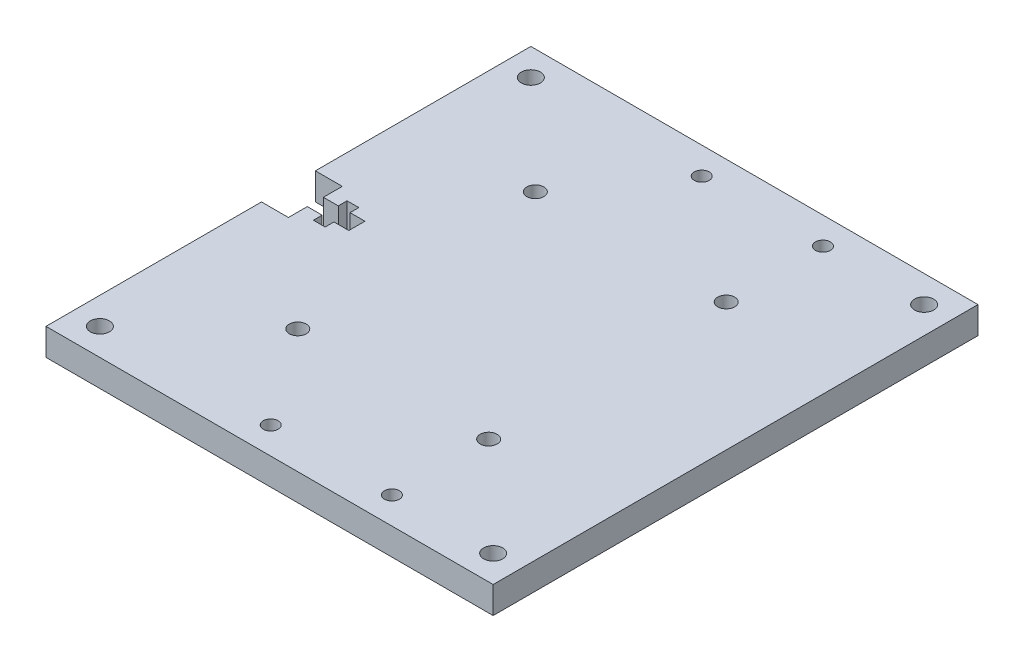
from build123d import *

# Parameters (mm, degrees)
SKETCH1_W                      = 105.41
SKETCH1_H                      = 114.3
BOSS_EXTRUDE1_DEPTH            = 3.175
F_4_0_4_DIAMETER_HOLE1_D       = 4
LPATTERN1_COUNT                = 2
LPATTERN1_PITCH                = 56
LPATTERN1_COUNT_DIR2           = 2
LPATTERN1_PITCH_DIR2           = 45
F_8_CLEARANCE_HOLE1_D          = 4.4958
MIRROR2_COPY_1_D               = 4.4958
F_6_CLEARANCE_HOLE1_AT_2_COUNT = 2
F_6_CLEARANCE_HOLE1_AT_2_PITCH = 28.575
CUT_EXTRUDE1_REACH             = 80.002


with BuildPart() as part:
    # Sketch1 → Boss-Extrude1 (new, symmetric)
    with BuildSketch(Plane(origin=(0, 0, 0), x_dir=(1, 0, 0), z_dir=(0, 1, 0))):
        Rectangle(SKETCH1_W, SKETCH1_H)
    extrude(amount=BOSS_EXTRUDE1_DEPTH, both=True)

    # Ø4.0 (4) Diameter Hole1 (through all)
    with Locations(Plane(origin=(0, 3.175, 0), x_dir=(1, 0, 0), z_dir=(0, 1, 0))):
        with Locations((22.5, 28)):
            f_4_0_4_diameter_hole1 = Hole(F_4_0_4_DIAMETER_HOLE1_D / 2)

    # LPattern1: 4.0 _4_ Diameter Hole1 2 × 2
    with Locations(*[(-j * LPATTERN1_PITCH_DIR2, 0, i * LPATTERN1_PITCH) for i in range(LPATTERN1_COUNT) for j in range(LPATTERN1_COUNT_DIR2) if (i, j) != (0, 0)]):
        add(f_4_0_4_diameter_hole1, mode=Mode.SUBTRACT)

    # #8 Clearance Hole1 (through all)
    with Locations(Plane(origin=(0, 3.175, 0), x_dir=(1, 0, 0), z_dir=(0, 1, 0))):
        with Locations((-46.355, 50.8)):
            f_8_clearance_hole1 = Hole(F_8_CLEARANCE_HOLE1_D / 2)

    # Mirror1: #8 Clearance Hole1 across plane
    add(f_8_clearance_hole1.mirror(Plane.XY), mode=Mode.SUBTRACT)

    # Mirror2: #8 Clearance Hole1 across plane
    add(f_8_clearance_hole1.mirror(Plane(origin=(0, 0, 0), x_dir=(0, 0, 1), z_dir=(1, 0, 0))), mode=Mode.SUBTRACT)

    # Mirror2 copy 1 (through all)
    with Locations(Plane(origin=(0, 3.175, 0), x_dir=(-1, 0, 0), z_dir=(0, 1, 0))):
        with Locations((-46.355, 50.8)):
            Hole(MIRROR2_COPY_1_D / 2)

    # Sketch6 → #6 Clearance Hole1 (revolve, cut)
    with BuildSketch(Plane(origin=(22.5, 3.175, -50.8), x_dir=(0, 0, 1), z_dir=(1, 0, 0))):
        Polygon((0, 0), (0, 7.403068321), (1.7526, 6.35), (1.7526, 0), align=None)
    f_6_clearance_hole1 = revolve(axis=Axis((22.5, 9.525, -50.8), (0, -1, 0)), mode=Mode.SUBTRACT)

    # #6 Clearance Hole1 at 2: #6 Clearance Hole1 ×2
    with Locations(*[(-i * F_6_CLEARANCE_HOLE1_AT_2_PITCH, 0, 0) for i in range(1, F_6_CLEARANCE_HOLE1_AT_2_COUNT)]):
        add(f_6_clearance_hole1, mode=Mode.SUBTRACT)

    # Sketch8 → Cut-Extrude1 (cut, up to next)
    with BuildSketch(Plane(origin=(0, 3.175, 0), x_dir=(1, 0, 0), z_dir=(0, 1, 0)), mode=Mode.PRIVATE) as cut_extrude1_sk1:
        Polygon((-52.705, -6.35), (-52.705, 6.35), (-46.355, 6.35), (-46.355, 1.89865), (-42.8545625, 1.89865), (-42.8545625, 3.96875), (-40.0764375, 3.96875), (-40.0764375, 1.89865), (-36.576, 1.89865), (-36.576, -1.89865), (-40.0764375, -1.89865), (-40.0764375, -3.96875), (-42.8545625, -3.96875), (-42.8545625, -1.89865), (-46.355, -1.89865), (-46.355, -6.35), align=None)
    cut_extrude1_tool1 = extrude(cut_extrude1_sk1.sketch, amount=-CUT_EXTRUDE1_REACH, mode=Mode.PRIVATE) & part.part
    add(cut_extrude1_tool1.solids().sort_by_distance((-46.496113, 3.175, 0))[0], mode=Mode.SUBTRACT)

    # Mirror3: #6 Clearance Hole1 across plane
    add(f_6_clearance_hole1.mirror(Plane.XY), mode=Mode.SUBTRACT)

    # Mirror3 copy 1 sketch → Mirror3 copy 1 (revolve, cut)
    with BuildSketch(Plane(origin=(-6.075, 3.175, 50.8), x_dir=(0, 0, -1), z_dir=(1, 0, 0))):
        Polygon((0, 0), (0, -7.403068321), (1.7526, -6.35), (1.7526, 0), align=None)
    revolve(axis=Axis((-6.075, 9.525, 50.8), (0, 1, 0)), mode=Mode.SUBTRACT)


solid = part.part
